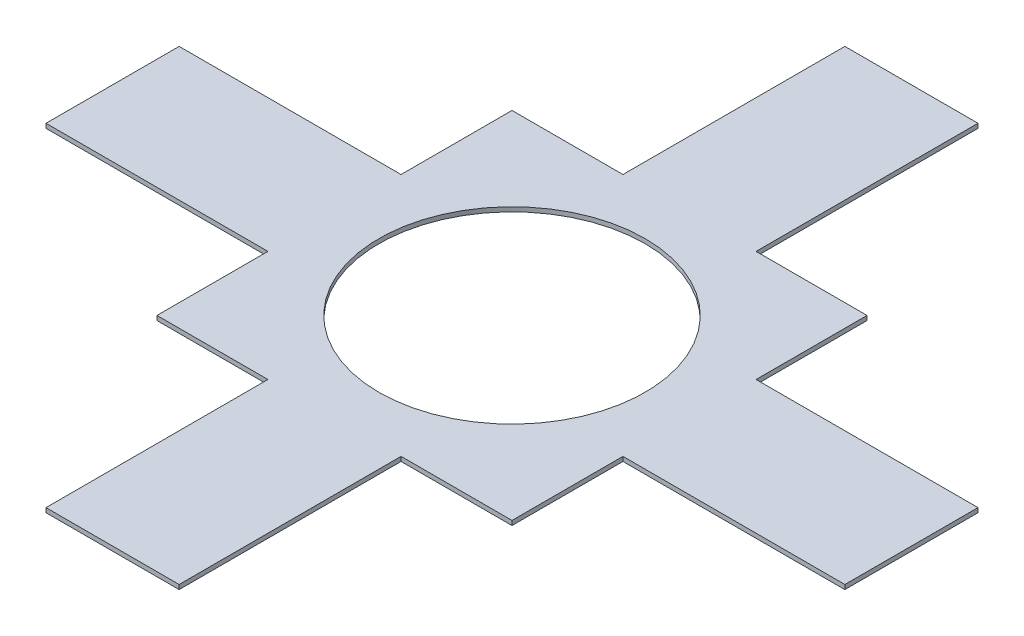
from build123d import *

# Parameters (mm, degrees)
SKETCH1_R           = 3
BOSS_EXTRUDE1_DEPTH = 0.1


with BuildPart() as part:
    # Sketch1 → Boss-Extrude1 (new body)
    with BuildSketch(Plane(origin=(0, 0, 0), x_dir=(1, 0, 0), z_dir=(0, 1, 0))):
        Polygon((-1.5, 4), (-1.5, 9), (1.5, 9), (1.5, 4), (4, 4), (4, 1.5), (9, 1.5), (9, -1.5), (4, -1.5), (4, -4), (1.5, -4), (1.5, -9), (-1.5, -9), (-1.5, -4), (-4, -4), (-4, -1.5), (-9, -1.5), (-9, 1.5), (-4, 1.5), (-4, 4), align=None)
        with Locations(Location((0, 0, 0), (0, 0, 270))):
            Circle(SKETCH1_R, mode=Mode.SUBTRACT)
    extrude(amount=BOSS_EXTRUDE1_DEPTH)


solid = part.part
